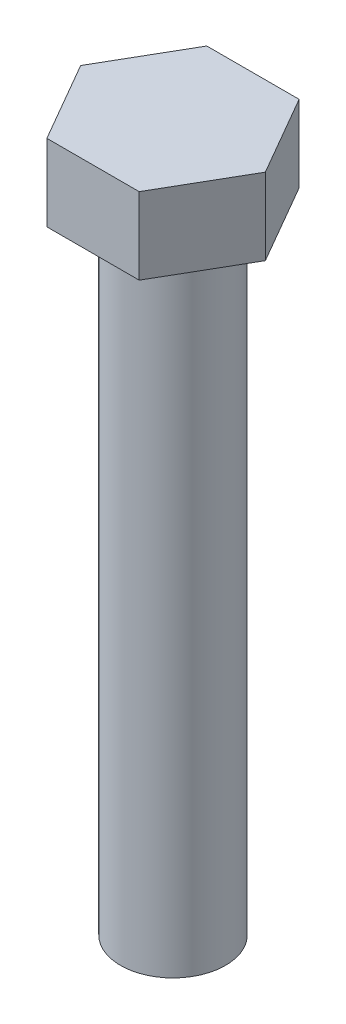
from build123d import *

# Parameters (mm, degrees)
BOSS_EXTRUDE1_DEPTH = 3.65
SKETCH2_R           = 2.5
BOSS_EXTRUDE2_DEPTH = 30


with BuildPart() as part:
    # Sketch1 → Boss-Extrude1 (new body)
    with BuildSketch(Plane(origin=(0, 0, 0), x_dir=(1, 0, 0), z_dir=(0, 1, 0))):
        Polygon((2.1975, -3.80618165), (4.395, 0), (2.1975, 3.80618165), (-2.1975, 3.80618165), (-4.395, 0), (-2.1975, -3.80618165), align=None)
    extrude(amount=BOSS_EXTRUDE1_DEPTH)

    # Sketch2 → Boss-Extrude2 (add)
    with BuildSketch(Plane.XZ):
        with Locations(Location((0, 0, 0), (0, 0, 270))):
            Circle(SKETCH2_R)
    extrude(amount=BOSS_EXTRUDE2_DEPTH)


solid = part.part
